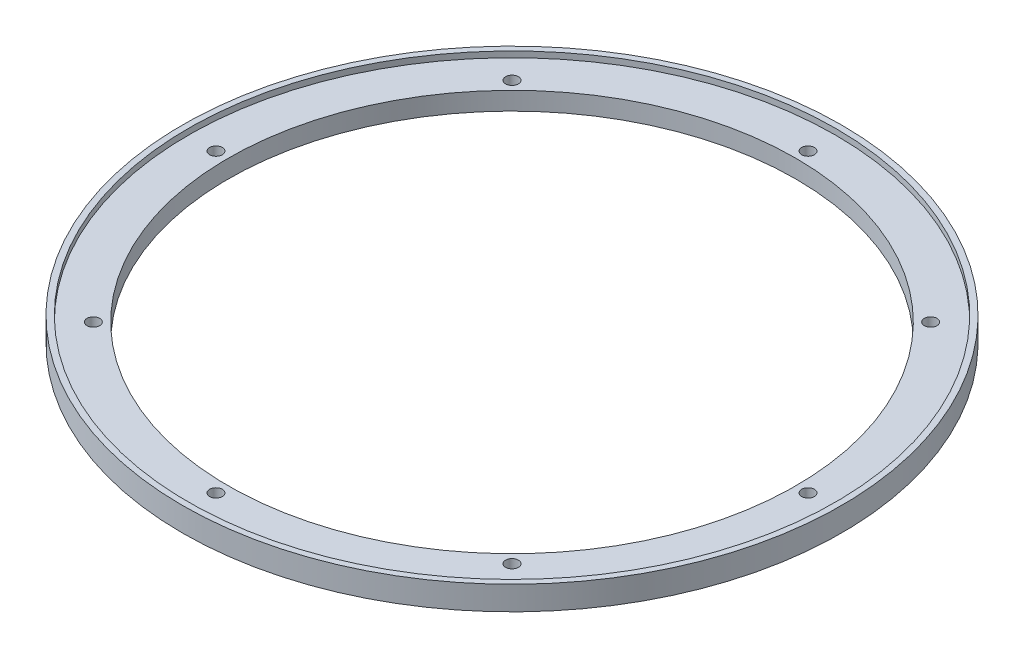
from build123d import *

# Parameters (mm, degrees)
CUT_EXTRUDE_1_REACH = 159.944
SKETCH_2_R          = 2.15


with BuildPart() as part:
    # 草图1 → 旋转1 (revolve)
    with BuildSketch(Plane.XY, mode=Mode.PRIVATE) as revolve_1_sk:
        Polygon((111.6, 6.1), (111.6, 8.1), (109.6, 8.1), (109.6, 6.1), (96.1, 6.1), (96.1, 0), (111.6, 0), align=None)
    revolve(revolve_1_sk.sketch.rotate(Axis((0, 0, 0), (0, 1, 0)), 90), axis=Axis((0, 0, 0), (0, 1, 0)))

    # 草图2 → 切除-拉伸1 (cut, up to next)
    with BuildSketch(Plane(origin=(0, 6.1, 0), x_dir=(1, 0, 0), z_dir=(0, 1, 0)), mode=Mode.PRIVATE) as cut_extrude_1_sk1:
        with Locations(Location((-100.25, 0, 0), (0, 0, 270))):
            Circle(SKETCH_2_R)
    cut_extrude_1_tool1 = extrude(cut_extrude_1_sk1.sketch, amount=-CUT_EXTRUDE_1_REACH, mode=Mode.PRIVATE) & part.part
    # 草图2 → 切除-拉伸1 (cut, up to next)
    with BuildSketch(Plane(origin=(0, 6.1, 0), x_dir=(1, 0, 0), z_dir=(0, 1, 0)), mode=Mode.PRIVATE) as cut_extrude_1_sk2:
        with Locations(Location((-70.887454814, 70.887454814, 0), (0, 0, 270))):
            Circle(SKETCH_2_R)
    cut_extrude_1_tool2 = extrude(cut_extrude_1_sk2.sketch, amount=-CUT_EXTRUDE_1_REACH, mode=Mode.PRIVATE) & part.part
    # 草图2 → 切除-拉伸1 (cut, up to next)
    with BuildSketch(Plane(origin=(0, 6.1, 0), x_dir=(1, 0, 0), z_dir=(0, 1, 0)), mode=Mode.PRIVATE) as cut_extrude_1_sk3:
        with Locations(Location((0, 100.25, 0), (0, 0, 270))):
            Circle(SKETCH_2_R)
    cut_extrude_1_tool3 = extrude(cut_extrude_1_sk3.sketch, amount=-CUT_EXTRUDE_1_REACH, mode=Mode.PRIVATE) & part.part
    # 草图2 → 切除-拉伸1 (cut, up to next)
    with BuildSketch(Plane(origin=(0, 6.1, 0), x_dir=(1, 0, 0), z_dir=(0, 1, 0)), mode=Mode.PRIVATE) as cut_extrude_1_sk4:
        with Locations(Location((70.887454814, 70.887454814, 0), (0, 0, 270))):
            Circle(SKETCH_2_R)
    cut_extrude_1_tool4 = extrude(cut_extrude_1_sk4.sketch, amount=-CUT_EXTRUDE_1_REACH, mode=Mode.PRIVATE) & part.part
    # 草图2 → 切除-拉伸1 (cut, up to next)
    with BuildSketch(Plane(origin=(0, 6.1, 0), x_dir=(1, 0, 0), z_dir=(0, 1, 0)), mode=Mode.PRIVATE) as cut_extrude_1_sk5:
        with Locations(Location((100.25, 0, 0), (0, 0, 270))):
            Circle(SKETCH_2_R)
    cut_extrude_1_tool5 = extrude(cut_extrude_1_sk5.sketch, amount=-CUT_EXTRUDE_1_REACH, mode=Mode.PRIVATE) & part.part
    # 草图2 → 切除-拉伸1 (cut, up to next)
    with BuildSketch(Plane(origin=(0, 6.1, 0), x_dir=(1, 0, 0), z_dir=(0, 1, 0)), mode=Mode.PRIVATE) as cut_extrude_1_sk6:
        with Locations(Location((70.887454814, -70.887454814, 0), (0, 0, 270))):
            Circle(SKETCH_2_R)
    cut_extrude_1_tool6 = extrude(cut_extrude_1_sk6.sketch, amount=-CUT_EXTRUDE_1_REACH, mode=Mode.PRIVATE) & part.part
    # 草图2 → 切除-拉伸1 (cut, up to next)
    with BuildSketch(Plane(origin=(0, 6.1, 0), x_dir=(1, 0, 0), z_dir=(0, 1, 0)), mode=Mode.PRIVATE) as cut_extrude_1_sk7:
        with Locations(Location((0, -100.25, 0), (0, 0, 270))):
            Circle(SKETCH_2_R)
    cut_extrude_1_tool7 = extrude(cut_extrude_1_sk7.sketch, amount=-CUT_EXTRUDE_1_REACH, mode=Mode.PRIVATE) & part.part
    # 草图2 → 切除-拉伸1 (cut, up to next)
    with BuildSketch(Plane(origin=(0, 6.1, 0), x_dir=(1, 0, 0), z_dir=(0, 1, 0)), mode=Mode.PRIVATE) as cut_extrude_1_sk8:
        with Locations(Location((-70.887454814, -70.887454814, 0), (0, 0, 270))):
            Circle(SKETCH_2_R)
    cut_extrude_1_tool8 = extrude(cut_extrude_1_sk8.sketch, amount=-CUT_EXTRUDE_1_REACH, mode=Mode.PRIVATE) & part.part
    add(cut_extrude_1_tool1.solids().sort_by_distance((-100.25, 6.1, 0))[0], mode=Mode.SUBTRACT)
    add(cut_extrude_1_tool2.solids().sort_by_distance((-70.887455, 6.1, -70.887455))[0], mode=Mode.SUBTRACT)
    add(cut_extrude_1_tool3.solids().sort_by_distance((0, 6.1, -100.25))[0], mode=Mode.SUBTRACT)
    add(cut_extrude_1_tool4.solids().sort_by_distance((70.887455, 6.1, -70.887455))[0], mode=Mode.SUBTRACT)
    add(cut_extrude_1_tool5.solids().sort_by_distance((100.25, 6.1, 0))[0], mode=Mode.SUBTRACT)
    add(cut_extrude_1_tool6.solids().sort_by_distance((70.887455, 6.1, 70.887455))[0], mode=Mode.SUBTRACT)
    add(cut_extrude_1_tool7.solids().sort_by_distance((0, 6.1, 100.25))[0], mode=Mode.SUBTRACT)
    add(cut_extrude_1_tool8.solids().sort_by_distance((-70.887455, 6.1, 70.887455))[0], mode=Mode.SUBTRACT)


solid = part.part
